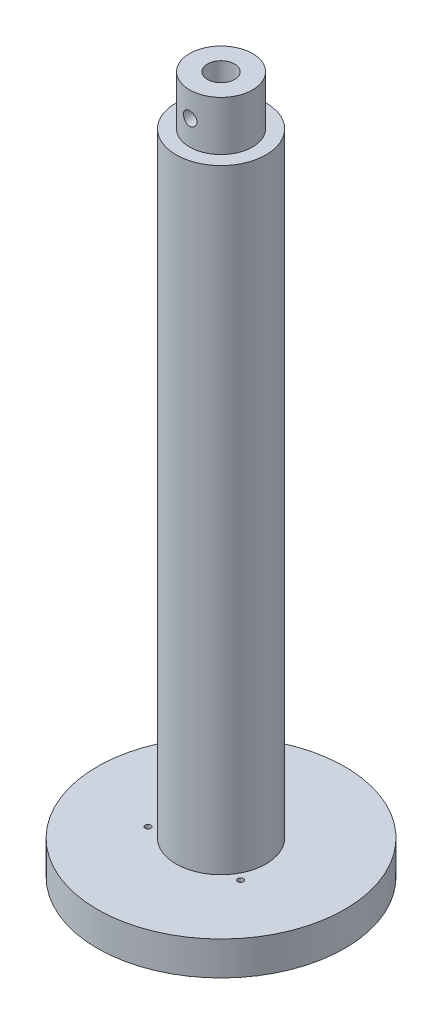
from build123d import *

# Parameters (mm, degrees)
SKETCH1_R               = 55
BOSS_EXTRUDE1_DEPTH     = 7.5
SKETCH2_R               = 20
BOSS_EXTRUDE2_DEPTH     = 273
SKETCH3_R               = 14
BOSS_EXTRUDE3_DEPTH     = 22
SKETCH4_R               = 53
CUT_EXTRUDE1_DEPTH      = 3
SKETCH5_R               = 6
CUT_EXTRUDE2_DEPTH      = 317.700173666
CUT_EXTRUDE3_DEPTH      = 313.339959019
CUT_EXTRUDE3_DEPTH_BACK = 313.339959019
SKETCH7_R               = 3
M3_TAPPED_HOLE1_D       = 2.5
M3_TAPPED_HOLE1_DEPTH   = 8
M3_TAPPED_HOLE1_TIP     = 0.751075774


with BuildPart() as part:
    # Sketch1 → Boss-Extrude1 (new, symmetric)
    with BuildSketch(Plane(origin=(0, 0, 0), x_dir=(1, 0, 0), z_dir=(0, 1, 0))):
        with Locations(Location((0, 0, 0), (0, 0, 270))):
            Circle(SKETCH1_R)
    extrude(amount=BOSS_EXTRUDE1_DEPTH, both=True)

    # Sketch2 → Boss-Extrude2 (add)
    with BuildSketch(Plane(origin=(0, 7.5, 0), x_dir=(1, 0, 0), z_dir=(0, 1, 0))):
        with Locations(Location((0, 0, 0), (0, 0, 270))):
            Circle(SKETCH2_R)
    extrude(amount=BOSS_EXTRUDE2_DEPTH)

    # Sketch3 → Boss-Extrude3 (add)
    with BuildSketch(Plane(origin=(0, 280.5, 0), x_dir=(1, 0, 0), z_dir=(0, 1, 0))):
        with Locations(Location((0, 0, 0), (0, 0, 270))):
            Circle(SKETCH3_R)
    extrude(amount=BOSS_EXTRUDE3_DEPTH)

    # Sketch4 → Cut-Extrude1 (cut)
    with BuildSketch(Plane.XZ.offset(7.5)):
        with Locations(Location((0, 0, 0), (0, 0, 270))):
            Circle(SKETCH4_R)
    extrude(amount=-CUT_EXTRUDE1_DEPTH, mode=Mode.SUBTRACT)

    # Sketch5 → Cut-Extrude2 (cut, through all)
    with BuildSketch(Plane.XZ.offset(4.5)):
        with Locations(Location((0, 0, 0), (0, 0, 270))):
            Circle(SKETCH5_R)
    extrude(amount=-CUT_EXTRUDE2_DEPTH, mode=Mode.SUBTRACT)

    # Sketch7 → Cut-Extrude3 (cut, two sides: drawn at the far end of the back side and taken through both)
    with BuildSketch(Plane.XY.offset(-CUT_EXTRUDE3_DEPTH_BACK)):
        with Locations((0, 291.5)):
            Circle(SKETCH7_R)
    extrude(amount=CUT_EXTRUDE3_DEPTH + CUT_EXTRUDE3_DEPTH_BACK, mode=Mode.SUBTRACT)

    # M3 Tapped Hole1
    with Locations(Plane(origin=(0, 7.5, 0), x_dir=(1, 0, 0), z_dir=(0, 1, 0))):
        with Locations((-20.56810334, -11.875), (20.56810334, -11.875), (0, 23.75)):
            Hole(M3_TAPPED_HOLE1_D / 2, depth=M3_TAPPED_HOLE1_DEPTH)
            with Locations((0, 0, -(M3_TAPPED_HOLE1_DEPTH + M3_TAPPED_HOLE1_TIP / 2))):  # 118° drill point
                Cone(0, M3_TAPPED_HOLE1_D / 2, M3_TAPPED_HOLE1_TIP, mode=Mode.SUBTRACT)


solid = part.part
